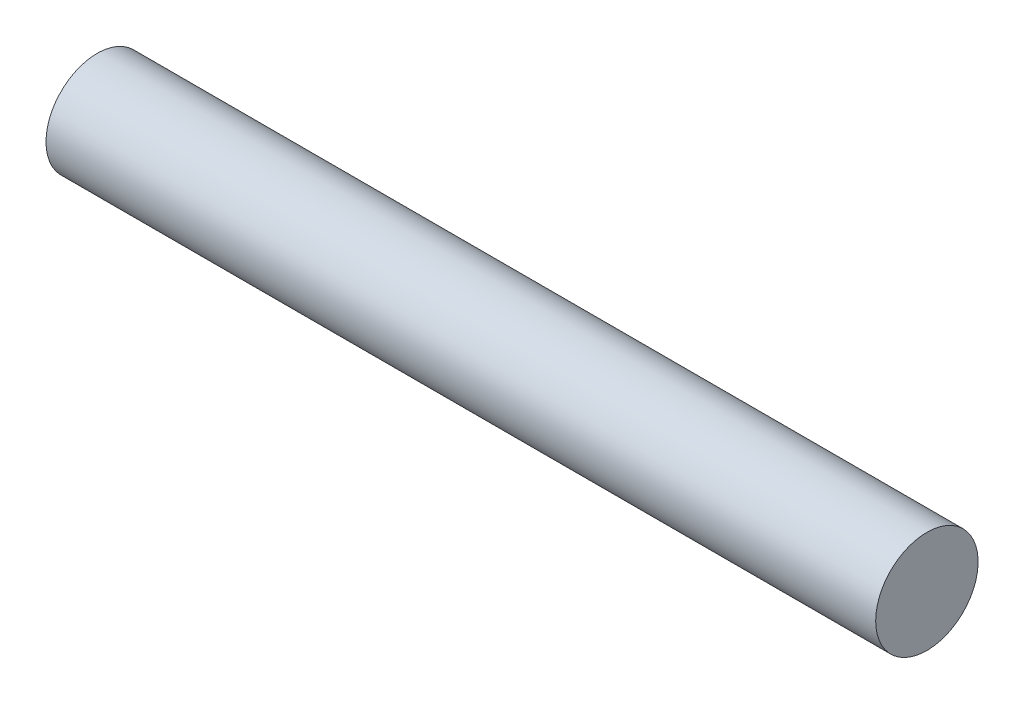
from build123d import *

# Parameters (mm, degrees)
SKETCH1_W = 162.000000052
SKETCH1_H = 9.999999812


with BuildPart() as part:
    # Sketch1 → Revolve1 (revolve)
    with BuildSketch(Plane.XY, mode=Mode.PRIVATE) as revolve1_sk:
        with Locations((2.6e-08, 0)):
            Rectangle(SKETCH1_W, SKETCH1_H)
    revolve(revolve1_sk.sketch.rotate(Axis((-81, -4.999999906, 0), (1, 0, 0)), 90), axis=Axis((-81, -4.999999906, 0), (1, 0, 0)))


solid = part.part
